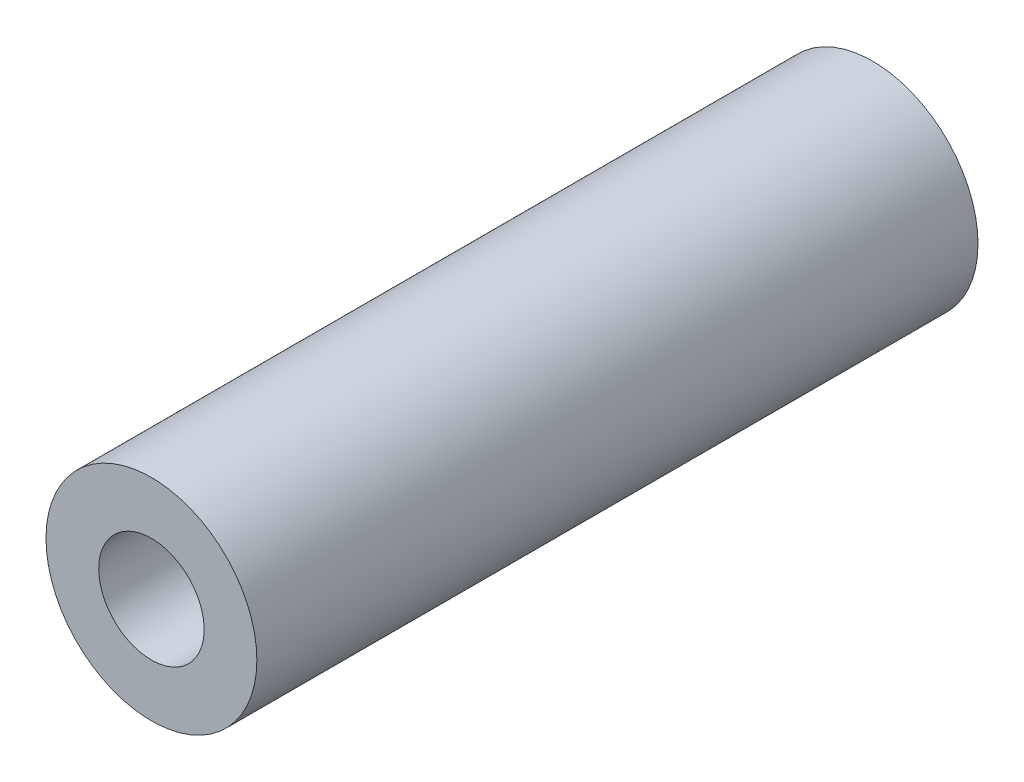
from build123d import *

# Parameters (mm, degrees)
SKETCH2_R           = 6.35
SKETCH2_R_2         = 3.175
BOSS_EXTRUDE1_DEPTH = 43.434


with BuildPart() as part:
    # Sketch2 → Boss-Extrude1 (new body)
    with BuildSketch(Plane.XY):
        with Locations(Location((0, 0, 0), (0, 0, 180))):
            Circle(SKETCH2_R)
        with Locations(Location((0, 0, 0), (0, 0, 180))):
            Circle(SKETCH2_R_2, mode=Mode.SUBTRACT)
    extrude(amount=BOSS_EXTRUDE1_DEPTH)


solid = part.part
